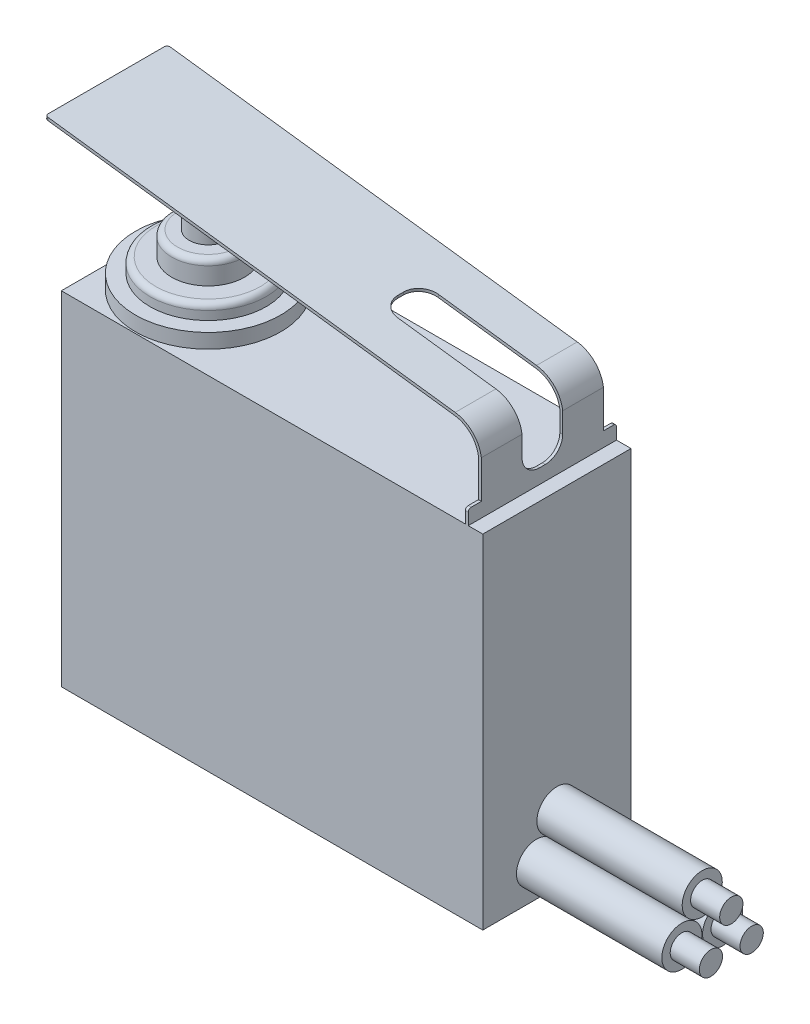
from build123d import *

# Parameters (mm, degrees)
SZKIC2_W                    = 14.5
SZKIC2_H                    = 5.1
DODANIE_WYCI_GNI_CIE1_DEPTH = 11.8
SZKIC3_R                    = 2.5
SZKIC3_R_2                  = 2
DODANIE_WYCI_GNI_CIE2_DEPTH = 0.5
SZKIC4_R                    = 2
DODANIE_WYCI_GNI_CIE3_DEPTH = 1
SZKIC5_R                    = 1.25
DODANIE_WYCI_GNI_CIE4_DEPTH = 0.8
SZKIC6_R                    = 0.65
DODANIE_WYCI_GNI_CIE5_DEPTH = 1
ZAOKR_GLENIE1_R             = 0.2
DODANIE_WYCI_GNI_CIE7_DEPTH = 5.1
SZKIC11_W                   = 0.45
SZKIC11_H                   = 5.401514826
WYTNIJ_WYCI_GNI_CIE2_DEPTH  = 23.306334437
WYTNIJ_WYCI_GNI_CIE3_DEPTH  = 0.778786
WYTNIJ_WYCI_GNI_CIE4_DEPTH  = 5
ZAOKR_GLENIE2_R             = 0.1
SZKIC14_R                   = 0.69
DODANIE_WYCI_GNI_CIE8_DEPTH = 5
SZKIC15_R                   = 0.4
DODANIE_WYCI_GNI_CIE9_DEPTH = 1
ZAOKR_GLENIE3_R             = 0.1


with BuildPart() as part:
    # Szkic2 → Dodanie-wyciągnięcie1 (new body)
    with BuildSketch(Plane(origin=(0, 0, 0), x_dir=(1, 0, 0), z_dir=(0, 1, 0))):
        Rectangle(SZKIC2_W, SZKIC2_H)
    extrude(amount=DODANIE_WYCI_GNI_CIE1_DEPTH)

    # Szkic3 → Dodanie-wyciągnięcie2 (add)
    with BuildSketch(Plane(origin=(0, 11.8, 0), x_dir=(1, 0, 0), z_dir=(0, 1, 0))):
        with Locations(Location((-4.75, 0, 0), (0, 0, 180))):
            Circle(SZKIC3_R)
        with Locations(Location((-4.75, 0, 0), (0, 0, 270))):
            Circle(SZKIC3_R_2, mode=Mode.SUBTRACT)
    extrude(amount=DODANIE_WYCI_GNI_CIE2_DEPTH)

    # Szkic4 → Dodanie-wyciągnięcie3 (add)
    with BuildSketch(Plane(origin=(0, 11.8, 0), x_dir=(1, 0, 0), z_dir=(0, 1, 0))):
        with Locations(Location((-4.75, 0, 0), (0, 0, 270))):
            Circle(SZKIC4_R)
    extrude(amount=DODANIE_WYCI_GNI_CIE3_DEPTH)

    # Szkic5 → Dodanie-wyciągnięcie4 (add)
    with BuildSketch(Plane(origin=(0, 12.8, 0), x_dir=(1, 0, 0), z_dir=(0, 1, 0))):
        with Locations(Location((-4.75, 0, 0), (0, 0, 270))):
            Circle(SZKIC5_R)
    extrude(amount=DODANIE_WYCI_GNI_CIE4_DEPTH)

    # Szkic6 → Dodanie-wyciągnięcie5 (add)
    with BuildSketch(Plane(origin=(0, 13.6, 0), x_dir=(1, 0, 0), z_dir=(0, 1, 0))):
        with Locations(Location((-4.75, 0, 0), (0, 0, 270))):
            Circle(SZKIC6_R)
    extrude(amount=DODANIE_WYCI_GNI_CIE5_DEPTH)

    # Zaokrąglenie1
    zaokr_glenie1_edges = [part.edges().sort_by_distance(p)[0] for p in [
        (-4.75, 12.8, -2),
        (-4.75, 13.6, -1.25),
    ]]
    fillet(zaokr_glenie1_edges, radius=ZAOKR_GLENIE1_R)

    # Szkic10 → Dodanie-wyciągnięcie7 (add)
    with BuildSketch(Plane.XY.offset(2.55)):
        with BuildLine():
            Line((6.75, 11.8), (6.75, 13.6))
            ThreePointArc((6.75, 13.6), (6.45374044, 14.20374044), (5.85, 14.5))
            Line((5.85, 14.5), (-8.25, 16.3))
            Line((-8.25, 16.3), (-8.262663189, 16.200805022))
            Line((-8.262663189, 16.200805022), (5.837336811, 14.400805022))
            ThreePointArc((5.837336811, 14.400805022), (6.378823054, 14.137558504), (6.65, 13.6))
            Line((6.65, 13.6), (6.65, 11.8))
            Line((6.65, 11.8), (6.75, 11.8))
        make_face()
    extrude(amount=-DODANIE_WYCI_GNI_CIE7_DEPTH)

    # Szkic11 → Wytnij-wyciągnięcie2 (cut, through all)
    with BuildSketch(Plane(origin=(6.75, 0, 0), x_dir=(0, 0, -1), z_dir=(1, 0, 0))):
        with Locations((-2.325, 15.000757413)):
            Rectangle(SZKIC11_W, SZKIC11_H)
        with Locations((2.325, 15.000757413)):
            Rectangle(SZKIC11_W, SZKIC11_H)
    extrude(amount=-WYTNIJ_WYCI_GNI_CIE2_DEPTH, mode=Mode.SUBTRACT)

    # Szkic12 → Wytnij-wyciągnięcie3 (cut)
    with BuildSketch(Plane(origin=(1.91518931, 15.002316258, 0), x_dir=(0.9919497796038491, -0.12663188675793827, 0), z_dir=(0.12663188675793827, 0.9919497796038491, 0))):
        with BuildLine():
            Line((-0.033256147, 0.1), (-0.033256147, -0.1))
            ThreePointArc((-0.033256147, -0.1), (0.142479784, -0.524264069), (0.566743853, -0.7))
            Line((0.566743853, -0.7), (3.966743853, -0.7))
            Line((3.966743853, -0.7), (8.34703338, -0.7))
            Line((8.34703338, -0.7), (8.34703338, 0.7))
            Line((8.34703338, 0.7), (3.966743853, 0.7))
            Line((3.966743853, 0.7), (0.566743853, 0.7))
            ThreePointArc((0.566743853, 0.7), (0.142479784, 0.524264069), (-0.033256147, 0.1))
        make_face()
    extrude(amount=-WYTNIJ_WYCI_GNI_CIE3_DEPTH, mode=Mode.SUBTRACT)

    # Szkic13 → Wytnij-wyciągnięcie4 (cut)
    with BuildSketch(Plane(origin=(6.75, 0, 0), x_dir=(0, 0, -1), z_dir=(1, 0, 0))):
        with BuildLine():
            Line((0.1, 12.3), (-0.1, 12.3))
            ThreePointArc((-0.1, 12.3), (-0.524264069, 12.475735931), (-0.7, 12.9))
            Line((-0.7, 12.9), (-0.7, 14.054695175))
            Line((-0.7, 14.054695175), (0.7, 14.054695175))
            Line((0.7, 14.054695175), (0.7, 12.9))
            ThreePointArc((0.7, 12.9), (0.524264069, 12.475735931), (0.1, 12.3))
        make_face()
    extrude(amount=-WYTNIJ_WYCI_GNI_CIE4_DEPTH, mode=Mode.SUBTRACT)

    # Zaokrąglenie2
    zaokr_glenie2_edges = [part.edges().sort_by_distance(p)[0] for p in [
        (-4.75, 14.6, -0.65),
    ]]
    fillet(zaokr_glenie2_edges, radius=ZAOKR_GLENIE2_R)

    # Szkic14 → Dodanie-wyciągnięcie8 (add)
    with BuildSketch(Plane(origin=(7.25, 0, 0), x_dir=(0, 0, -1), z_dir=(1, 0, 0))):
        with Locations(Location((0, 2.31, 0), (0, 0, 180))):
            Circle(SZKIC14_R)
        with Locations(Location((0.701480577, 1.095, 0), (0, 0, 180))):
            Circle(SZKIC14_R)
        with Locations(Location((-0.701480577, 1.095, 0), (0, 0, 180))):
            Circle(SZKIC14_R)
    extrude(amount=DODANIE_WYCI_GNI_CIE8_DEPTH)

    # Szkic15 → Dodanie-wyciągnięcie9 (add)
    with BuildSketch(Plane(origin=(12.25, 0, 0), x_dir=(0, 0, -1), z_dir=(1, 0, 0))):
        with Locations((0, 2.31)):
            Circle(SZKIC15_R)
        with Locations((0.701480577, 1.095)):
            Circle(SZKIC15_R)
        with Locations((-0.701480577, 1.095)):
            Circle(SZKIC15_R)
    extrude(amount=DODANIE_WYCI_GNI_CIE9_DEPTH)

    # Zaokrąglenie3
    zaokr_glenie3_edges = [part.edges().sort_by_distance(p)[0] for p in [
        (-8.256331594, 16.250402511, -2.1),
        (6.7, 12.3, -2.55),
        (-8.256331594, 16.250402511, 2.1),
        (6.7, 12.3, 2.55),
    ]]
    fillet(zaokr_glenie3_edges, radius=ZAOKR_GLENIE3_R)


solid = part.part
